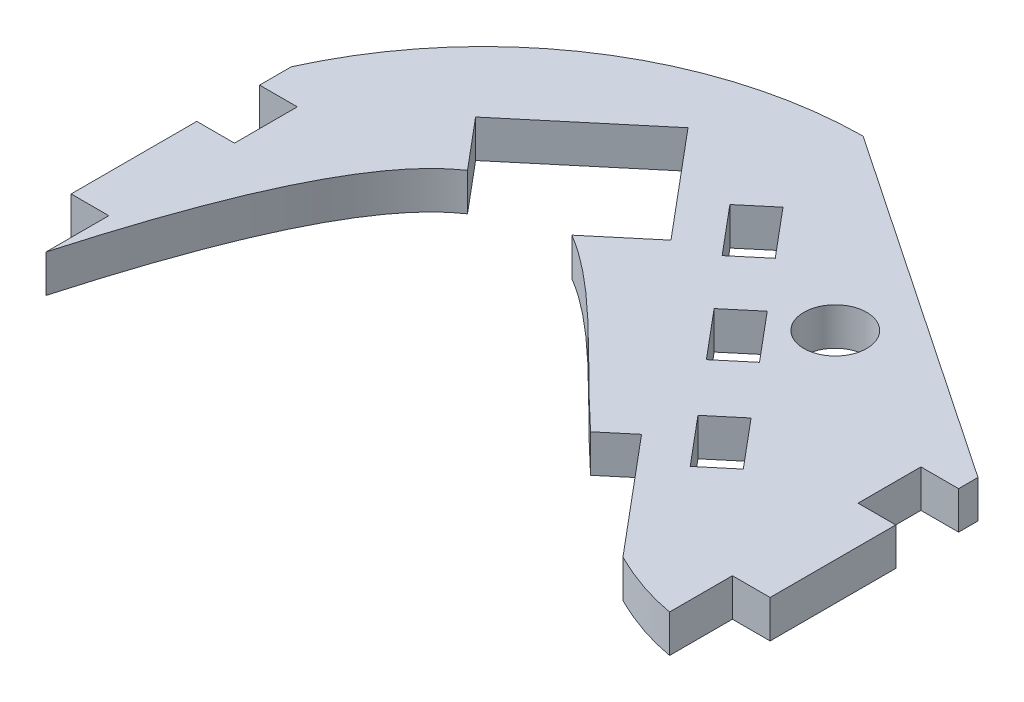
from build123d import *

# Parameters (mm, degrees)
CROQUIS1_R                 = 30.5
SALIENTE_EXTRUIR1_DEPTH    = 3
CROQUIS2_R                 = 2
CORTAR_EXTRUIR1_DEPTH      = 4
CORTAR_EXTRUIR3_START      = -4
CORTAR_EXTRUIR3_DEPTH      = 4
CORTAR_EXTRUIR5_START      = -4
CORTAR_EXTRUIR5_DEPTH      = 4
CORTAR_EXTRUIR6_DEPTH      = 10
CROQUIS10_R                = 2.5
CORTAR_EXTRUIR7_DEPTH      = 3
CORTAR_EXTRUIR8_DEPTH      = 44.237715166
CORTAR_EXTRUIR8_DEPTH_BACK = 44.237715166
CORTAR_EXTRUIR9_START      = -10
CORTAR_EXTRUIR9_DEPTH      = 10


with BuildPart() as part:
    # Croquis1 → Saliente-Extruir1 (new body)
    with BuildSketch(Plane(origin=(0, 0, 0), x_dir=(1, 0, 0), z_dir=(0, 1, 0))):
        with Locations(Location((0, 0, 0), (0, 0, 270))):
            Circle(CROQUIS1_R)
    extrude(amount=SALIENTE_EXTRUIR1_DEPTH)

    # Croquis2 → Cortar-Extruir1 (cut)
    with BuildSketch(Plane(origin=(0, 3, 0), x_dir=(1, 0, 0), z_dir=(0, 1, 0))):
        with Locations(Location((0, 0, 0), (0, 0, 270))):
            Circle(CROQUIS2_R)
    extrude(amount=-CORTAR_EXTRUIR1_DEPTH, mode=Mode.SUBTRACT)

    # Croquis5 → Cortar-Extruir3 (cut)
    with BuildSketch(Plane(origin=(0, 3, 0), x_dir=(1, 0, 0), z_dir=(0, 1, 0)).offset(CORTAR_EXTRUIR3_START)):
        with BuildLine():
            Line((28.814059068, 5), (30.087372767, 5))
            ThreePointArc((30.087372767, 5), (29.556634924, 7.526973624), (28.814059068, 10))
            Line((28.814059068, 10), (24.814059068, 10))
            Line((24.814059068, 10), (24.814059068, 5))
            Line((24.814059068, 5), (28.814059068, 5))
        make_face()
        with BuildLine():
            Line((30.087372767, -5), (28.814059068, -5))
            Line((28.814059068, -5), (24.814059068, -5))
            Line((24.814059068, -5), (24.814059068, -10))
            Line((24.814059068, -10), (28.814059068, -10))
            ThreePointArc((28.814059068, -10), (29.556634924, -7.526973624), (30.087372767, -5))
        make_face()
        with BuildLine():
            Line((-24.814059068, 5), (-24.814059068, 10))
            Line((-24.814059068, 10), (-28.814059068, 10))
            ThreePointArc((-28.814059068, 10), (-29.556634924, 7.526973624), (-30.087372767, 5))
            Line((-30.087372767, 5), (-28.814059068, 5))
            Line((-28.814059068, 5), (-24.814059068, 5))
        make_face()
        with BuildLine():
            Line((-28.814059068, -10), (-24.814059068, -10))
            Line((-24.814059068, -10), (-24.814059068, -5))
            Line((-24.814059068, -5), (-28.814059068, -5))
            Line((-28.814059068, -5), (-30.087372767, -5))
            ThreePointArc((-30.087372767, -5), (-29.556634924, -7.526973624), (-28.814059068, -10))
        make_face()
    extrude(amount=CORTAR_EXTRUIR3_DEPTH, mode=Mode.SUBTRACT)

    # Croquis7 → Cortar-Extruir5 (cut)
    with BuildSketch(Plane(origin=(0, 3, 0), x_dir=(1, 0, 0), z_dir=(0, 1, 0)).offset(CORTAR_EXTRUIR5_START)):
        Polygon((1.428390211, 22.411430151), (-0.869743118, 20.483067322), (2.34419493, 16.652845106), (4.642328259, 18.581207935), align=None)
        with BuildLine():
            Line((-24.814059068, -10), (-28.814059068, -10))
            ThreePointArc((-28.814059068, -10), (0, -30.5), (28.814059068, -10))
            Line((28.814059068, -10), (24.814059068, -10))
            add(Edge.make_bspline(
                [(24.814059068, -10), (22.863263717, -9.657344338), (20.984021298, -8.980450277), (19.168992989, -8.065339906)],
                knots=[0, 0, 0, 0, 0.087850084, 0.087850084, 0.087850084, 0.087850084], degree=3))
            Line((19.168992989, -8.065339906), (11.455541673, 1.127193412))
            Line((11.455541673, 1.127193412), (9.248678515, -0.72458465))
            add(Edge.make_bspline(
                [(9.248678515, -0.72458465), (4.033234859, 4.116641048), (-0.646914404, 9.508508747), (-5.04935939, 12.080675515)],
                knots=[0.258799312, 0.258799312, 0.258799312, 0.258799312, 0.546435258, 0.546435258, 0.546435258, 0.546435258], degree=3))
            Line((-5.04935939, 12.080675515), (-0.757422911, 15.682037831))
            Line((-0.757422911, 15.682037831), (-7.828086618, 24.108526705))
            Line((-7.828086618, 24.108526705), (-17.020619935, 16.395075389))
            Line((-17.020619935, 16.395075389), (-13.66601447, 12.397212273))
            add(Edge.make_bspline(
                [(-13.66601447, 12.397212273), (-17.403465693, 9.897923685), (-21.056529869, 3.255841362), (-24.814059068, -10)],
                knots=[0.740637404, 0.740637404, 0.740637404, 0.740637404, 1, 1, 1, 1], degree=3))
        make_face()
        Polygon((14.685884661, 6.611763511), (12.387751331, 4.683400682), (15.60168938, 0.853178467), (17.899822709, 2.781541296), align=None)
    extrude(amount=CORTAR_EXTRUIR5_DEPTH, mode=Mode.SUBTRACT)

    # Croquis9 → Cortar-Extruir6 (cut)
    with BuildSketch(Plane(origin=(0, 3, 0), x_dir=(1, 0, 0), z_dir=(0, 1, 0))):
        Polygon((7.971418181, 14.613753061), (5.673284852, 12.685390231), (8.887222901, 8.855168016), (11.18535623, 10.783530845), align=None)
    extrude(amount=-CORTAR_EXTRUIR6_DEPTH, mode=Mode.SUBTRACT)

    # Croquis10 → Cortar-Extruir7 (cut)
    with BuildSketch(Plane(origin=(0, 3, 0), x_dir=(1, 0, 0), z_dir=(0, 1, 0))):
        with Locations(Location((12, 16, 0), (0, 0, 270))):
            Circle(CROQUIS10_R)
    extrude(amount=-CORTAR_EXTRUIR7_DEPTH, mode=Mode.SUBTRACT)

    # Croquis11 → Cortar-Extruir8 (cut, two sides: drawn at the far end of the back side and taken through both)
    with BuildSketch(Plane(origin=(0, 3, 0), x_dir=(1, 0, 0), z_dir=(0, 1, 0)).offset(-CORTAR_EXTRUIR8_DEPTH_BACK)):
        with BuildLine():
            Line((30.087372767, 5), (27.814059068, 5))
            Line((27.814059068, 5), (27.814059068, -5))
            Line((27.814059068, -5), (30.087372767, -5))
            ThreePointArc((30.087372767, -5), (30.5, 0), (30.087372767, 5))
        make_face()
        with BuildLine():
            ThreePointArc((28.814059068, 10), (28.341972277, 11.268655974), (27.814059068, 12.515115586))
            Line((27.814059068, 12.515115586), (27.814059068, 10))
            Line((27.814059068, 10), (28.814059068, 10))
        make_face()
        with BuildLine():
            Line((-27.814059068, -5), (-27.814059068, 5))
            Line((-27.814059068, 5), (-30.087372767, 5))
            ThreePointArc((-30.087372767, 5), (-30.5, 0), (-30.087372767, -5))
            Line((-30.087372767, -5), (-27.814059068, -5))
        make_face()
        with BuildLine():
            Line((-28.814059068, 10), (-27.814059068, 10))
            Line((-27.814059068, 10), (-27.814059068, 12.515115586))
            ThreePointArc((-27.814059068, 12.515115586), (-28.341972277, 11.268655974), (-28.814059068, 10))
        make_face()
    extrude(amount=CORTAR_EXTRUIR8_DEPTH + CORTAR_EXTRUIR8_DEPTH_BACK, mode=Mode.SUBTRACT)

    # Croquis12 → Cortar-Extruir9 (cut)
    with BuildSketch(Plane(origin=(0, 3, 0), x_dir=(1, 0, 0), z_dir=(0, 1, 0)).offset(CORTAR_EXTRUIR9_START)):
        with BuildLine():
            Line((-0.28585192, 30.498660441), (27.814059068, 11.545031156))
            Line((27.814059068, 11.545031156), (27.814059068, 12.515115586))
            ThreePointArc((27.814059068, 12.515115586), (16.440879495, 25.689442995), (-0.28585192, 30.498660441))
        make_face()
    extrude(amount=CORTAR_EXTRUIR9_DEPTH, mode=Mode.SUBTRACT)


solid = part.part
